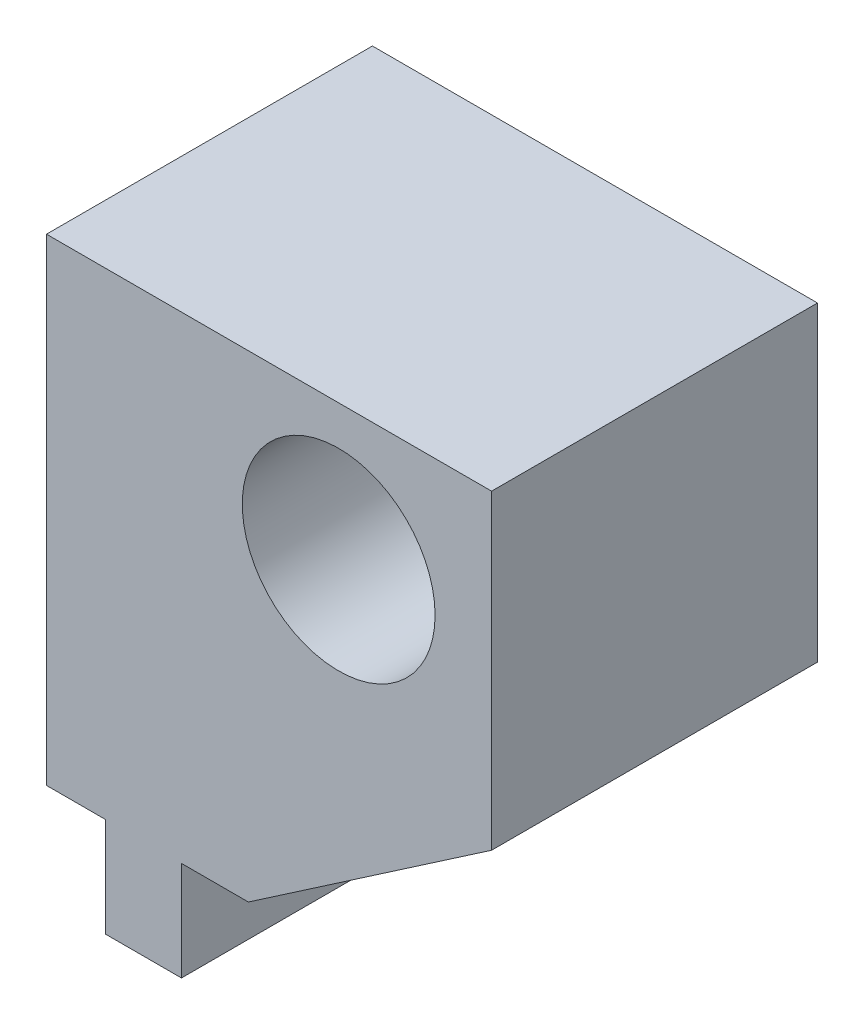
from build123d import *

# Parameters (mm, degrees)
SKETCH1_R           = 10.65
BOSS_EXTRUDE1_DEPTH = 36


with BuildPart() as part:
    # Sketch1 → Boss-Extrude1 (new body)
    with BuildSketch(Plane.XY):
        Polygon((-11.427868524, 15), (16.890245931, 15), (16.890245931, 4.290865346), (16.890245931, -19.355478958), (-9.97487005, -37.737828582), (-17.367207375, -37.737828582), (-17.367207375, -48.703128948), (-25.745189678, -48.703128948), (-25.745189678, -37.737828582), (-32.275087648, -37.737828582), (-32.275087648, 11.174803388), (-32.275087648, 15), align=None)
        Circle(SKETCH1_R, mode=Mode.SUBTRACT)
    extrude(amount=BOSS_EXTRUDE1_DEPTH)


solid = part.part
